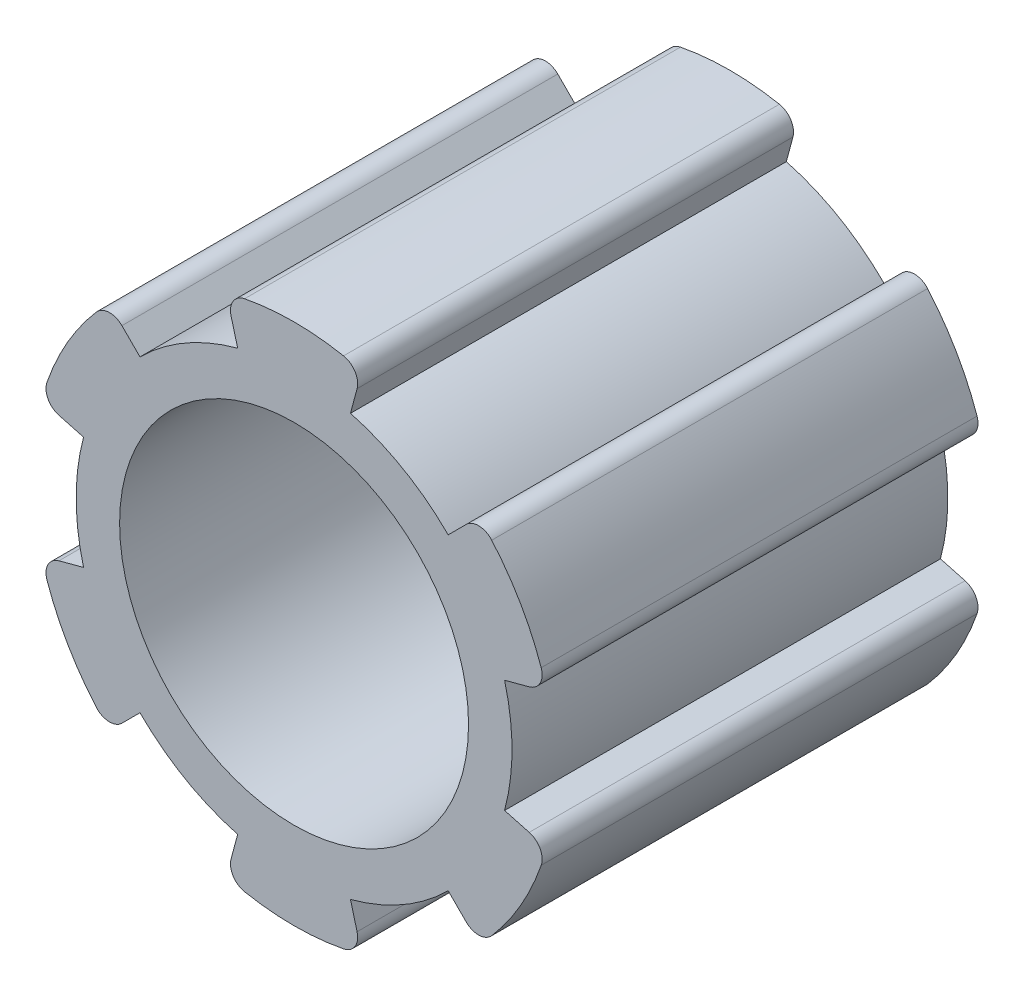
from build123d import *

# Parameters (mm, degrees)
SKETCH1_R                = 25
SKETCH1_R_2              = 20.015
BOSS_EXTRUDE1_DEPTH      = 50
BOSS_EXTRUDE2_DEPTH      = 50
FILLET1_R                = 2
CIRPATTERN1_COUNT        = 6
FILLET1_OF_CIRPATTERN1_R = 2


with BuildPart() as part:
    # Sketch1 → Boss-Extrude1 (new body)
    with BuildSketch(Plane.XY):
        Circle(SKETCH1_R)
        Circle(SKETCH1_R_2, mode=Mode.SUBTRACT)
    extrude(amount=-BOSS_EXTRUDE1_DEPTH)

    # Sketch2 → Boss-Extrude2 (add)
    with BuildSketch(Plane.XY):
        with BuildLine():
            Line((6.470476128, 24.148145657), (7.764571353, 28.977774789))
            ThreePointArc((7.764571353, 28.977774789), (0, 30), (-7.764571353, 28.977774789))
            Line((-7.764571353, 28.977774789), (-6.470476128, 24.148145657))
            ThreePointArc((-6.470476128, 24.148145657), (0, 25), (6.470476128, 24.148145657))
        make_face()
    boss_extrude2 = extrude(amount=-BOSS_EXTRUDE2_DEPTH)

    # Fillet1
    fillet1_edges = [part.edges().sort_by_distance(p)[0] for p in [
        (-7.764571353, 28.977774789, -25),
        (7.764571353, 28.977774789, -25),
    ]]
    fillet(fillet1_edges, radius=FILLET1_R)

    # CirPattern1: Boss-Extrude2 ×6 about axis
    cirpattern1_axis = Axis((0, 0, 0), (0, 0, 1))
    for i in range(1, CIRPATTERN1_COUNT):
        add(boss_extrude2.rotate(cirpattern1_axis, i * 360 / CIRPATTERN1_COUNT))

    # Fillet1 of CirPattern1
    fillet1_of_cirpattern1_edges = [part.edges().sort_by_distance(p)[0] for p in [
        (-28.977774789, 7.764571353, -25),
        (-21.213203436, 21.213203436, -25),
        (-21.213203436, -21.213203436, -25),
        (-28.977774789, -7.764571353, -25),
        (7.764571353, -28.977774789, -25),
        (-7.764571353, -28.977774789, -25),
        (28.977774789, -7.764571353, -25),
        (21.213203436, -21.213203436, -25),
        (21.213203436, 21.213203436, -25),
        (28.977774789, 7.764571353, -25),
    ]]
    fillet(fillet1_of_cirpattern1_edges, radius=FILLET1_OF_CIRPATTERN1_R)


solid = part.part
